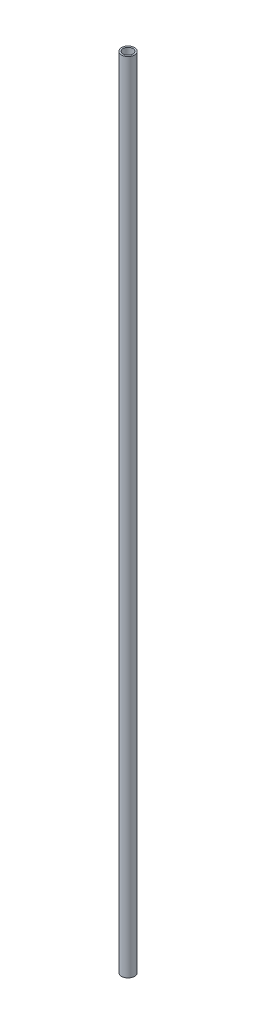
from build123d import *

# Parameters (mm, degrees)
SKETCH1_R           = 0.9144
SKETCH1_R_2         = 0.6858
BOSS_EXTRUDE1_DEPTH = 112.7


with BuildPart() as part:
    # Sketch1 → Boss-Extrude1 (new body)
    with BuildSketch(Plane(origin=(0, 0, 0), x_dir=(1, 0, 0), z_dir=(0, 1, 0))):
        with Locations(Location((0, 0, 0), (0, 0, 90))):
            Circle(SKETCH1_R)
        with Locations(Location((0, 0, 0), (0, 0, 90))):
            Circle(SKETCH1_R_2, mode=Mode.SUBTRACT)
    extrude(amount=BOSS_EXTRUDE1_DEPTH)


solid = part.part
